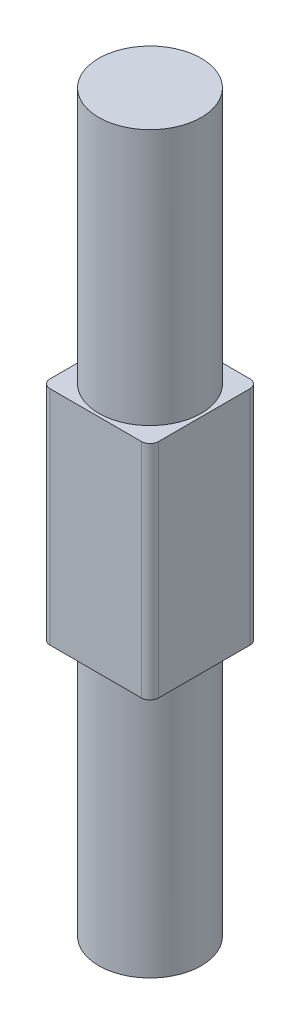
from build123d import *

# Parameters (mm, degrees)
ESQUISSE1_W             = 6.35
ESQUISSE1_H             = 6.35
BOSS_EXTRU_1_DEPTH      = 13
BOSS_EXTRU_2_DEPTH      = 15
BOSS_EXTRU_2_DEPTH_BACK = 28
ESQUISSE2_R             = 3
CONG_1_R                = 0.5


with BuildPart() as part:
    # Esquisse1 → Boss.-Extru.1 (new body)
    with BuildSketch(Plane(origin=(0, 0, 0), x_dir=(1, 0, 0), z_dir=(0, 1, 0))):
        with Locations((3.175, 3.175)):
            Rectangle(ESQUISSE1_W, ESQUISSE1_H)
    extrude(amount=BOSS_EXTRU_1_DEPTH)

    # Esquisse2 → Boss.-Extru.2 (add, two sides: drawn at the far end of the back side and taken through both)
    with BuildSketch(Plane(origin=(0, 13, 0), x_dir=(1, 0, 0), z_dir=(0, 1, 0)).offset(-BOSS_EXTRU_2_DEPTH_BACK)):
        with Locations(Location((3.175, 3.175, 0), (0, 0, 270))):
            Circle(ESQUISSE2_R)
    extrude(amount=BOSS_EXTRU_2_DEPTH + BOSS_EXTRU_2_DEPTH_BACK)

    # Congé1
    cong_1_edges = [part.edges().sort_by_distance(p)[0] for p in [
        (0, 6.5, -6.35),
        (6.35, 6.5, -6.35),
        (6.35, 6.5, 0),
        (0, 6.5, 0),
    ]]
    fillet(cong_1_edges, radius=CONG_1_R)


solid = part.part
